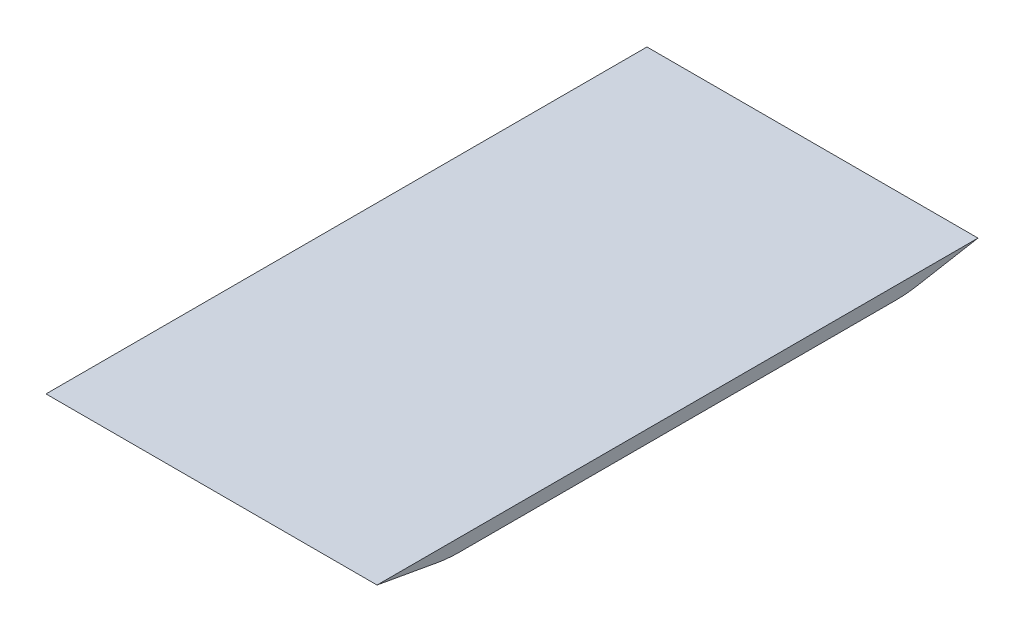
from build123d import *

# Parameters (mm, degrees)
BOSS_EXTRUDE1_DEPTH = 130
FILLET1_R           = 50


with BuildPart() as part:
    # Sketch1 → Boss-Extrude1 (new body)
    with BuildSketch(Plane(origin=(0, 0, 0), x_dir=(0, 0, -1), z_dir=(1, 0, 0))):
        Polygon((0, 0), (236, 0), (208, -5), (28, -5), align=None)
    extrude(amount=BOSS_EXTRUDE1_DEPTH)

    # Fillet1
    fillet1_edges = [part.edges().sort_by_distance(p)[0] for p in [
        (65, -5, -208),
        (65, -5, -28),
    ]]
    fillet(fillet1_edges, radius=FILLET1_R)


solid = part.part
